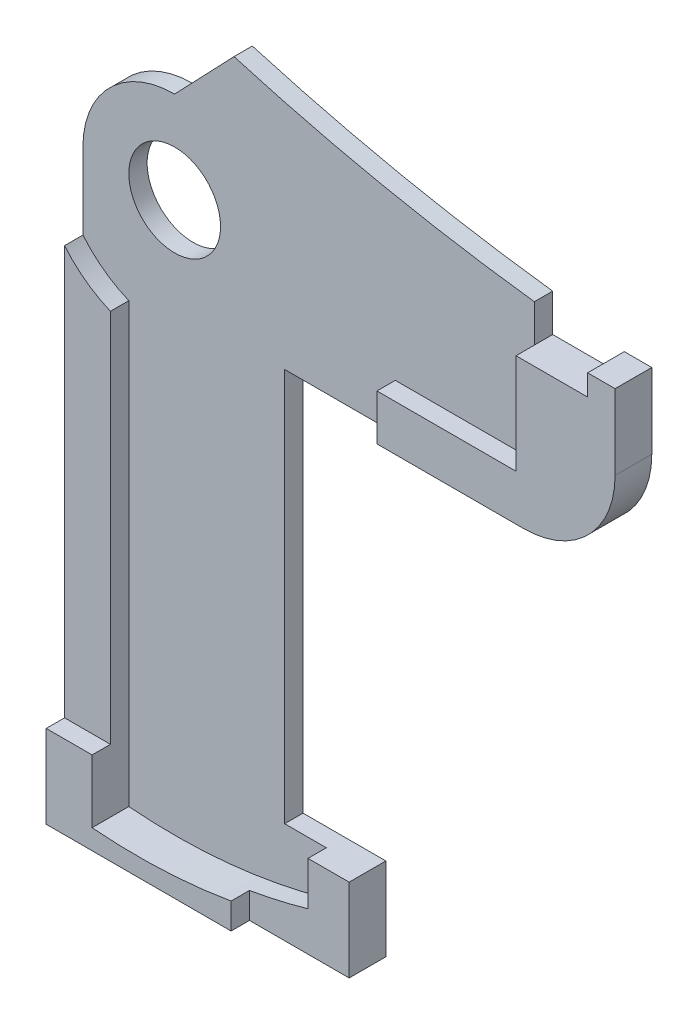
from build123d import *

# Parameters (mm, degrees)
EXTRUDE_3_DEPTH = 3
EXTRUDE_4_DEPTH = 2
SKETCH_1_8_R    = 2.5
EXTRUDE_5_DEPTH = 1


with BuildPart() as part:
    # 스케치1 → 보스-돌출3 (new body)
    with BuildSketch(Plane.XY):
        with BuildLine():
            Line((-2.5, -26.437677825), (-5, -26.437677825))
            Line((-5, -26.437677825), (-5, -30.96175738))
            Line((-5, -30.96175738), (5.076141326, -30.96175738))
            Line((5.076141326, -30.96175738), (5.076141326, -29.54601506))
            ThreePointArc((5.076141326, -29.54601506), (1.298498135, -29.950761581), (-2.5, -29.874474333))
            Line((-2.5, -29.874474333), (-2.5, -26.437677825))
        make_face()
    extrude(amount=EXTRUDE_3_DEPTH)

    # 스케치1<7> → 보스-돌출4 (add)
    with BuildSketch(Plane.XY):
        with BuildLine():
            Line((23.502499093, 2.950728465), (19.6, 2.950728465))
            Line((19.6, 2.950728465), (19.6, -2.5))
            Line((19.6, -2.5), (12.023157318, -2.5))
            Line((12.023157318, -2.5), (12.023157318, -5))
            Line((12.023157318, -5), (20, -5))
            ThreePointArc((20, -5), (23.535533906, -3.535533906), (25, 0))
            Line((25, 0), (25, 4.09591659))
            Line((25, 4.09591659), (23.502499093, 4.09591659))
            Line((23.502499093, 4.09591659), (23.502499093, 2.950728465))
        make_face()
        with BuildLine():
            ThreePointArc((-2.5, -6), (-3.862002616, -5.228282299), (-5, -4.153311931))
            Line((-5, -4.153311931), (-5, -26.437677825))
            Line((-5, -26.437677825), (-2.5, -26.437677825))
            Line((-2.5, -26.437677825), (-2.5, -6))
        make_face()
        with BuildLine():
            Line((5.076141326, -29.54601506), (5.076141326, -30.96175738))
            Line((5.076141326, -30.96175738), (10.508252403, -30.96175738))
            Line((10.508252403, -30.96175738), (10.508252403, -26.437677825))
            Line((10.508252403, -26.437677825), (8.264928228, -26.437677825))
            Line((8.264928228, -26.437677825), (8.264928228, -28.81709871))
            ThreePointArc((8.264928228, -28.81709871), (6.680483813, -29.225080884), (5.076141326, -29.54601506))
        make_face()
    extrude(amount=EXTRUDE_4_DEPTH)


with BuildPart() as extrude_4_piece_1:
    # of the separate pieces the step leaves, piece 1, a body of its own (extrude_4_pieces)
    add(part.part.solids().sort_by_distance((-2.5, -29.874474333, 0))[0])



with BuildPart() as extrude_4_piece_2:
    # of the separate pieces the step leaves, piece 2, a body of its own (extrude_4_pieces)
    add(part.part.solids().sort_by_distance((23.502499093, 2.950728465, 0))[0])


with BuildPart() as extrude_4_piece_1_1:
    add(extrude_4_piece_1.part)

    add(extrude_4_piece_2.part)  # 보스-돌출5 merges 보스-돌출4 piece 2
    # 스케치1<8> → 보스-돌출5 (add)
    with BuildSketch(Plane.XY):
        with BuildLine():
            Line((3.231912185, 8.38327913), (0, 5))
            ThreePointArc((0, 5), (-3.535533906, 3.535533906), (-5, 0))
            Line((-5, 0), (-5, -4.153311931))
            ThreePointArc((-5, -4.153311931), (-3.862002616, -5.228282299), (-2.5, -6))
            Line((-2.5, -6), (-2.5, -29.874474333))
            ThreePointArc((-2.5, -29.874474333), (2.93054776, -29.83531643), (8.264928228, -28.81709871))
            Line((8.264928228, -28.81709871), (8.264928228, -26.437677825))
            Line((8.264928228, -26.437677825), (5.994868924, -26.437677825))
            Line((5.994868924, -26.437677825), (5.994868924, -5))
            Line((5.994868924, -5), (12.023157318, -5))
            Line((12.023157318, -5), (12.023157318, -2.5))
            Line((12.023157318, -2.5), (19.6, -2.5))
            Line((19.6, -2.5), (19.6, 5))
            ThreePointArc((19.6, 5), (11.347380216, 6.359873864), (3.231912185, 8.38327913))
        make_face()
        Circle(SKETCH_1_8_R, mode=Mode.SUBTRACT)
    extrude(amount=EXTRUDE_5_DEPTH)


solid = extrude_4_piece_1_1.part
